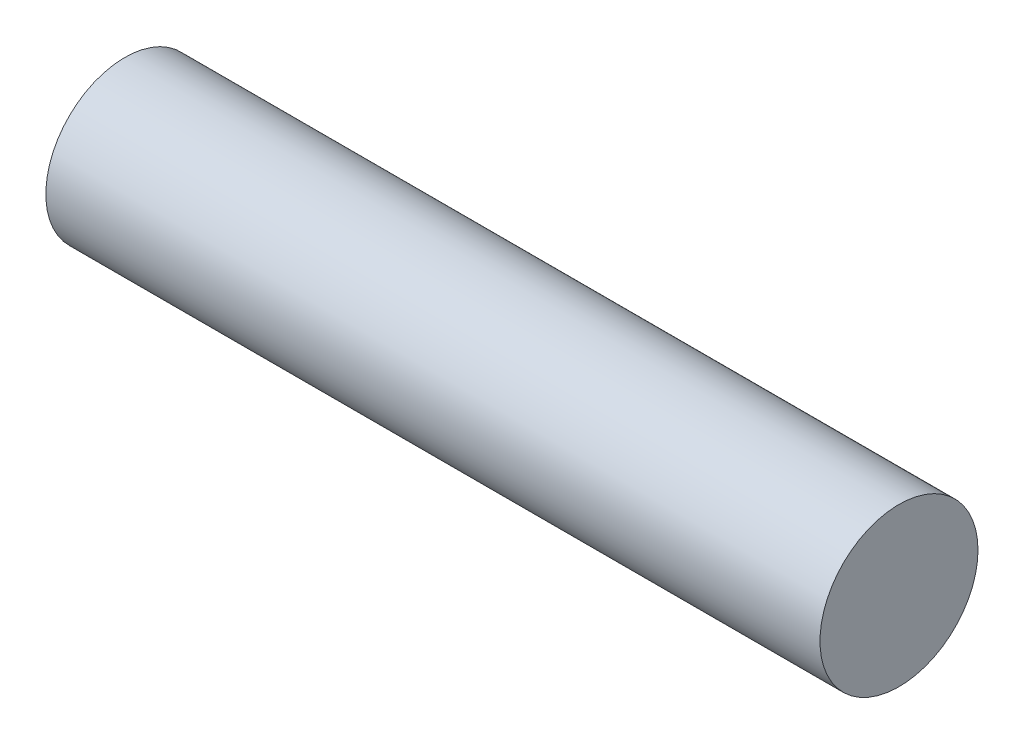
from build123d import *

# Parameters (mm, degrees)
SKETCH1_R           = 31.75
BOSS_EXTRUDE1_DEPTH = 311.15


with BuildPart() as part:
    # Sketch1 → Boss-Extrude1 (new body)
    with BuildSketch(Plane(origin=(0, 0, 0), x_dir=(0, 0, -1), z_dir=(1, 0, 0))):
        Circle(SKETCH1_R)
    extrude(amount=BOSS_EXTRUDE1_DEPTH)


solid = part.part
